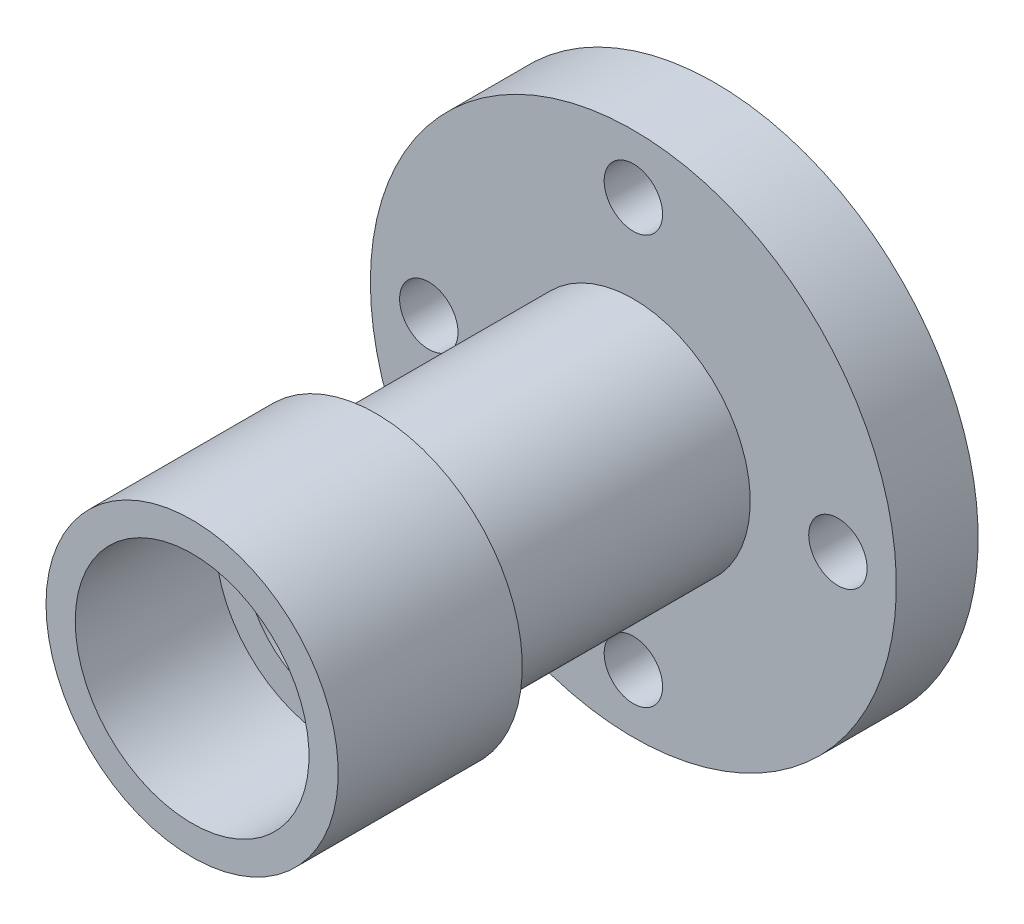
from build123d import *

# Parameters (mm, degrees)
SKETCH2_R          = 5
CUT_EXTRUDE1_DEPTH = 110.819169547


with BuildPart() as part:
    # Sketch1 → Revolve1 (revolve)
    with BuildSketch(Plane(origin=(0, 0, 0), x_dir=(0, 0, -1), z_dir=(1, 0, 0)), mode=Mode.PRIVATE) as revolve1_sk:
        Polygon((0, 25), (0, 20), (24, 20), (24, 15), (33.5, 15), (33.5, 17), (35.5, 17), (35.5, 15), (48, 15), (48, 18.5), (51.5, 18.5), (51.5, 15), (63.5, 15), (63.5, 17), (65.5, 17), (65.5, 15), (86, 15), (89.5, 18.5), (89.5, 23), (83.5, 23), (83.5, 27), (89.5, 27), (89.5, 45), (75.5, 45), (75.5, 20), (31.5, 20), (31.5, 25), align=None)
    revolve(revolve1_sk.sketch.rotate(Axis((0, 0, -114.136596419), (0, 0, 1)), 90), axis=Axis((0, 0, -114.136596419), (0, 0, 1)))

    # Sketch2 → Cut-Extrude1 (cut, through all)
    with BuildSketch(Plane(origin=(0, 0, -89.5), x_dir=(-1, 0, 0), z_dir=(0, 0, -1))):
        with Locations((0, 35)):
            Circle(SKETCH2_R)
        with Locations((35, 0)):
            Circle(SKETCH2_R)
        with Locations((0, -35)):
            Circle(SKETCH2_R)
        with Locations((-35, 0)):
            Circle(SKETCH2_R)
    extrude(amount=-CUT_EXTRUDE1_DEPTH, mode=Mode.SUBTRACT)


solid = part.part
